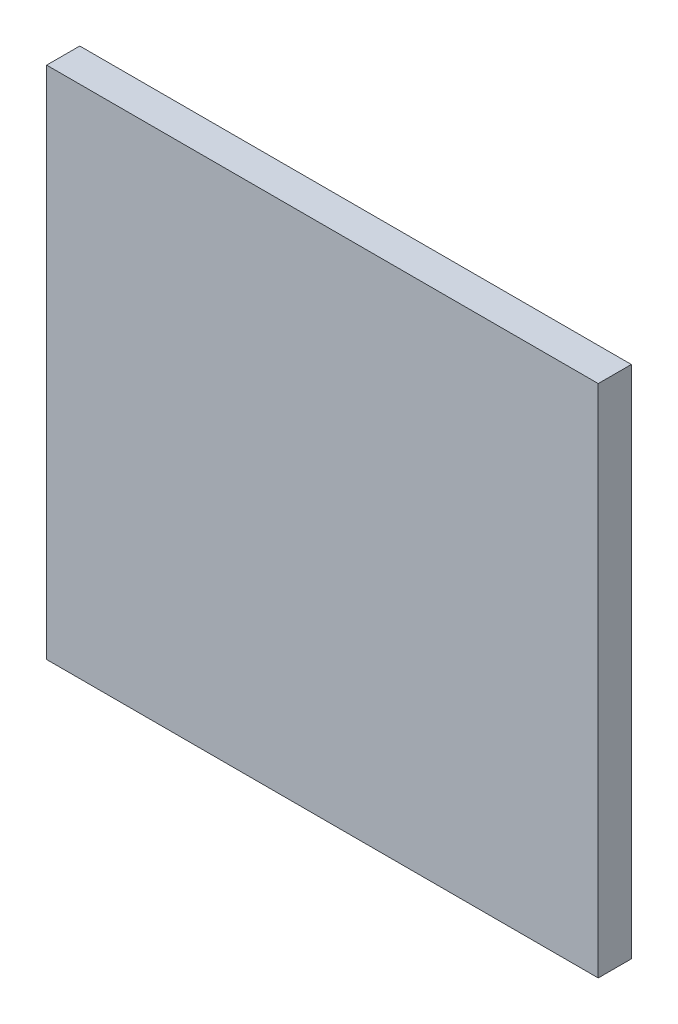
from build123d import *

# Parameters (mm, degrees)
SKETCH1_W           = 30
SKETCH1_H           = 28
BOSS_EXTRUDE1_DEPTH = 1.8


with BuildPart() as part:
    # Sketch1 → Boss-Extrude1 (new body)
    with BuildSketch(Plane.XY):
        Rectangle(SKETCH1_W, SKETCH1_H)
    extrude(amount=BOSS_EXTRUDE1_DEPTH)


solid = part.part
